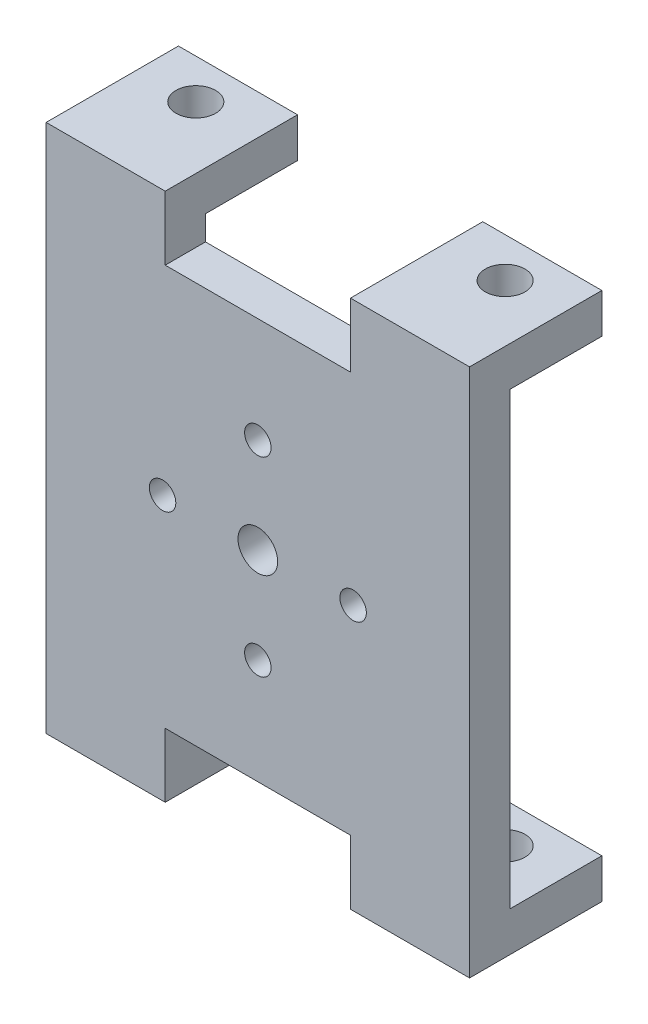
from build123d import *

# Parameters (mm, degrees)
BOSS_EXTRUDE1_DEPTH      = 2
BOSS_EXTRUDE1_DEPTH_BACK = 1.043576075
SKETCH1_W                = 32
SKETCH1_H                = 40
CUT_EXTRUDE3_DEPTH       = 26.792699652
CUT_EXTRUDE3_DEPTH_BACK  = 26.792699652
SKETCH5_R                = 1.5
SKETCH5_R_2              = 1
SKETCH_4_W               = 14
SKETCH_4_H               = 4.843949414
CUT_EXTRUDE_3_DEPTH      = 26.792699652
SKETCH_5_W               = 9
SKETCH_5_H               = 3
EXTRUDE_3_DEPTH          = 10
SKETCH_6_R               = 1.5
CUT_EXTRUDE_5_DEPTH      = 44.8178046


with BuildPart() as part:
    # Sketch1 → Boss-Extrude1 (new, two sides: drawn at the far end of the back side and taken through both)
    with BuildSketch(Plane.XY.offset(-BOSS_EXTRUDE1_DEPTH_BACK)):
        Rectangle(SKETCH1_W, SKETCH1_H)
    extrude(amount=BOSS_EXTRUDE1_DEPTH + BOSS_EXTRUDE1_DEPTH_BACK)

    # Sketch5 → Cut-Extrude3 (cut, two sides: drawn at the far end of the back side and taken through both)
    with BuildSketch(Plane.XY.offset(2).offset(-CUT_EXTRUDE3_DEPTH_BACK)):
        Circle(SKETCH5_R)
        with Locations((0, 7.2)):
            Circle(SKETCH5_R_2)
        with Locations((7.2, 0)):
            Circle(SKETCH5_R_2)
        with Locations((0, -7.2)):
            Circle(SKETCH5_R_2)
        with Locations((-7.2, 0)):
            Circle(SKETCH5_R_2)
    extrude(amount=CUT_EXTRUDE3_DEPTH + CUT_EXTRUDE3_DEPTH_BACK, mode=Mode.SUBTRACT)

    # 草图4 → 切除-拉伸3 (cut, through all)
    with BuildSketch(Plane.XY.offset(2)):
        with Locations((0, 17.578025293)):
            Rectangle(SKETCH_4_W, SKETCH_4_H)
        with Locations((0, -17.578025293)):
            Rectangle(SKETCH_4_W, SKETCH_4_H)
    extrude(amount=-CUT_EXTRUDE_3_DEPTH, mode=Mode.SUBTRACT)

    # 草图5 → 凸台-拉伸3 (add)
    with BuildSketch(Plane.XY.offset(2)):
        with Locations((11.5, 18.5)):
            Rectangle(SKETCH_5_W, SKETCH_5_H)
        with Locations((-11.5, 18.5)):
            Rectangle(SKETCH_5_W, SKETCH_5_H)
        with Locations((-11.5, -18.5)):
            Rectangle(SKETCH_5_W, SKETCH_5_H)
        with Locations((11.5, -18.5)):
            Rectangle(SKETCH_5_W, SKETCH_5_H)
    extrude(amount=-EXTRUDE_3_DEPTH)

    # 草图6 → 切除-拉伸5 (cut, through all)
    with BuildSketch(Plane.XZ.offset(20)):
        with Locations(Location((11.6894988, -5, 0), (0, 0, 270))):
            Circle(SKETCH_6_R)
        with Locations(Location((-11.6894988, -5, 0), (0, 0, 270))):
            Circle(SKETCH_6_R)
    extrude(amount=-CUT_EXTRUDE_5_DEPTH, mode=Mode.SUBTRACT)


solid = part.part
